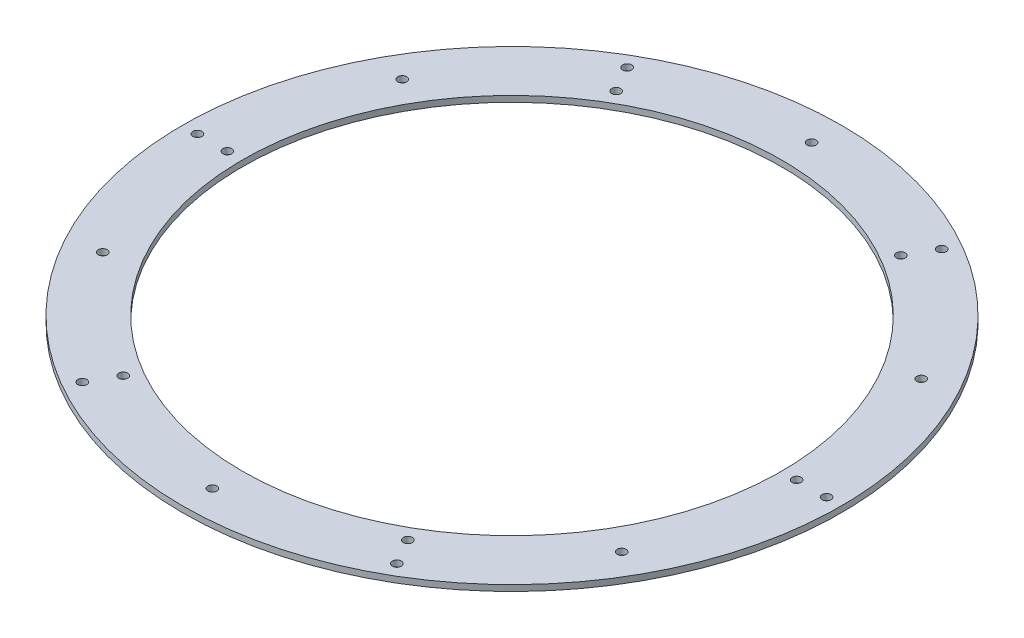
from build123d import *

# Parameters (mm, degrees)
SKETCH1_R           = 110
SKETCH1_R_2         = 90
SKETCH1_R_3         = 1.5
BOSS_EXTRUDE1_DEPTH = 2


with BuildPart() as part:
    # Sketch1 → Boss-Extrude1 (new body)
    with BuildSketch(Plane(origin=(0, 0, 0), x_dir=(1, 0, 0), z_dir=(0, 1, 0))):
        with Locations(Location((0, 0, 0), (0, 0, 270))):
            Circle(SKETCH1_R)
        with Locations(Location((0, 0, 0), (0, 0, 270))):
            Circle(SKETCH1_R_2, mode=Mode.SUBTRACT)
        with Locations(Location((95, 0, 0), (0, 0, 270))):
            Circle(SKETCH1_R_3, mode=Mode.SUBTRACT)
        with Locations(Location((105, 0, 0), (0, 0, 270))):
            Circle(SKETCH1_R_3, mode=Mode.SUBTRACT)
        with Locations(Location((86.602540378, 50, 0), (0, 0, 270))):
            Circle(SKETCH1_R_3, mode=Mode.SUBTRACT)
        with Locations(Location((86.602540378, -50, 0), (0, 0, 270))):
            Circle(SKETCH1_R_3, mode=Mode.SUBTRACT)
        with Locations(Location((52.5, -90.932667397, 0), (0, 0, 270))):
            Circle(SKETCH1_R_3, mode=Mode.SUBTRACT)
        with Locations(Location((47.5, -82.27241336, 0), (0, 0, 270))):
            Circle(SKETCH1_R_3, mode=Mode.SUBTRACT)
        with Locations(Location((0, -100, 0), (0, 0, 270))):
            Circle(SKETCH1_R_3, mode=Mode.SUBTRACT)
        with Locations(Location((-52.5, -90.932667397, 0), (0, 0, 270))):
            Circle(SKETCH1_R_3, mode=Mode.SUBTRACT)
        with Locations(Location((-47.5, -82.27241336, 0), (0, 0, 270))):
            Circle(SKETCH1_R_3, mode=Mode.SUBTRACT)
        with Locations(Location((-86.602540378, -50, 0), (0, 0, 270))):
            Circle(SKETCH1_R_3, mode=Mode.SUBTRACT)
        with Locations(Location((-105, 0, 0), (0, 0, 270))):
            Circle(SKETCH1_R_3, mode=Mode.SUBTRACT)
        with Locations(Location((-95, 0, 0), (0, 0, 270))):
            Circle(SKETCH1_R_3, mode=Mode.SUBTRACT)
        with Locations(Location((-86.602540378, 50, 0), (0, 0, 270))):
            Circle(SKETCH1_R_3, mode=Mode.SUBTRACT)
        with Locations(Location((-52.5, 90.932667397, 0), (0, 0, 270))):
            Circle(SKETCH1_R_3, mode=Mode.SUBTRACT)
        with Locations(Location((-47.5, 82.27241336, 0), (0, 0, 270))):
            Circle(SKETCH1_R_3, mode=Mode.SUBTRACT)
        with Locations(Location((0, 100, 0), (0, 0, 270))):
            Circle(SKETCH1_R_3, mode=Mode.SUBTRACT)
        with Locations(Location((52.5, 90.932667397, 0), (0, 0, 270))):
            Circle(SKETCH1_R_3, mode=Mode.SUBTRACT)
        with Locations(Location((47.5, 82.27241336, 0), (0, 0, 270))):
            Circle(SKETCH1_R_3, mode=Mode.SUBTRACT)
    extrude(amount=BOSS_EXTRUDE1_DEPTH)


solid = part.part
